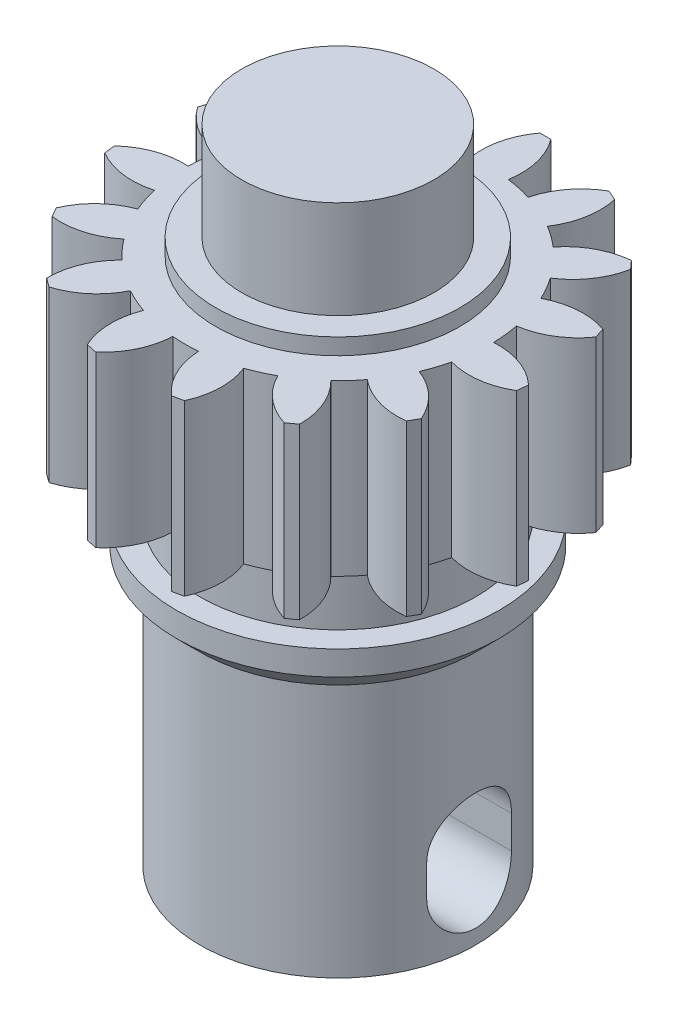
from build123d import *

# Parameters (mm, degrees)
RESSALTO_EXTRUS_O1_START = -10.4
RESSALTO_EXTRUS_O1_DEPTH = 10.4
PADR_OCIRCULAR1_COUNT    = 15
ESBO_O3_R                = 3.3
CORTE_EXTRUS_O1_DEPTH    = 22
CORTE_EXTRUS_O4_DEPTH    = 20


with BuildPart() as part:
    # Esboço1 → Revolução1 (revolve)
    with BuildSketch(Plane.XY, mode=Mode.PRIVATE) as revolu_o1_sk:
        Polygon((0, 0), (0, 39.4), (5.9, 39.4), (5.9, 33.4), (7.5, 33.4), (7.5, 32.4), (9.374, 32.4), (9.374, 22), (8.47, 22), (8.47, 18.51), (9.9, 18.51), (9.9, 17.01), (8.47, 15.58), (8.47, 0), align=None)
    revolve(revolu_o1_sk.sketch.rotate(Axis((0, 0, 0), (0, 1, 0)), 90), axis=Axis((0, 0, 0), (0, 1, 0)))

    # Esboço2 → Ressalto-extrusão1 (add)
    with BuildSketch(Plane(origin=(0, 32.4, 0), x_dir=(1, 0, 0), z_dir=(0, 1, 0)).offset(RESSALTO_EXTRUS_O1_START)):
        with BuildLine():
            Line((-0.337, 12.746), (0.337, 12.746))
            ThreePointArc((0.337, 12.746), (1.105703178, 11.108702403), (1.167644885, 9.300993572))
            ThreePointArc((1.167644885, 9.300993572), (0, 9.374), (-1.167644885, 9.300993572))
            ThreePointArc((-1.167644885, 9.300993572), (-1.105703178, 11.108702403), (-0.337, 12.746))
        make_face()
    ressalto_extrus_o1 = extrude(amount=RESSALTO_EXTRUS_O1_DEPTH)

    # PadrãoCircular1: Ressalto-extrusão1 ×15 about axis
    padr_ocircular1_axis = Axis((0, 0, 0), (0, 1, 0))
    for i in range(1, PADR_OCIRCULAR1_COUNT):
        add(ressalto_extrus_o1.rotate(padr_ocircular1_axis, i * 360 / PADR_OCIRCULAR1_COUNT))

    # Esboço3 → Corte-extrusão1 (cut)
    with BuildSketch(Plane.XZ):
        with Locations(Location((0, 0, 0), (0, 0, 270))):
            Circle(ESBO_O3_R)
    extrude(amount=-CORTE_EXTRUS_O1_DEPTH, mode=Mode.SUBTRACT)

    # Esboço7 → Corte-extrusão4 (cut, symmetric)
    with BuildSketch(Plane(origin=(0, 0, 0), x_dir=(0, 0, -1), z_dir=(1, 0, 0))):
        with BuildLine():
            Line((-2.6, 5.5), (-2.6, 3.5))
            ThreePointArc((-2.6, 3.5), (0, 0.9), (2.6, 3.5))
            Line((2.6, 3.5), (2.6, 5.5))
            ThreePointArc((2.6, 5.5), (0, 8.1), (-2.6, 5.5))
        make_face()
    extrude(amount=CORTE_EXTRUS_O4_DEPTH, both=True, mode=Mode.SUBTRACT)


solid = part.part
